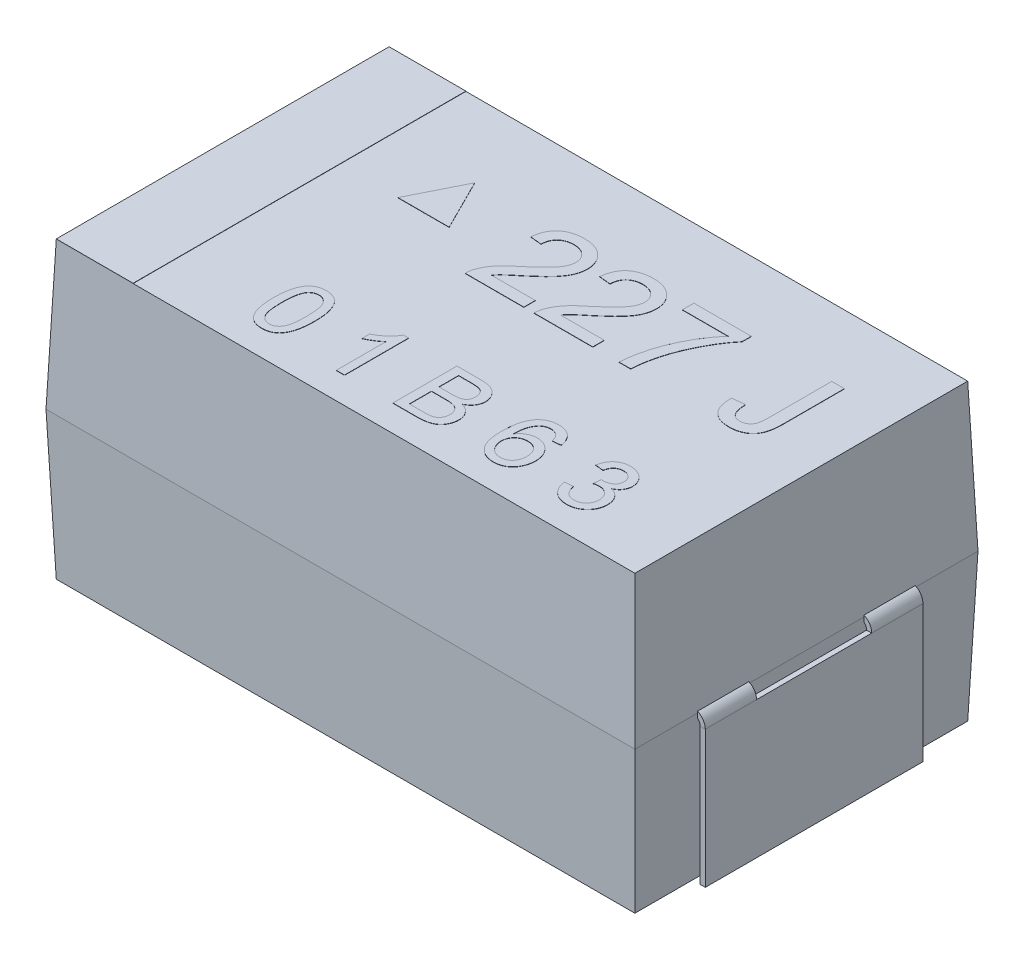
from build123d import *

# Parameters (mm, degrees)
SKETCH1_W           = 5.842
SKETCH1_H           = 3.4036
BOSS_EXTRUDE1_DEPTH = 1.4605
CUT_EXTRUDE1_DEPTH  = 4.682583942
CUT_EXTRUDE2_DEPTH  = 4.682583942
SKETCH4_W           = 0.508
SKETCH4_H           = 0.0508
SKETCH6_W           = 0.508
SKETCH6_H           = 0.0508
SKETCH8_W           = 1.143
SKETCH8_H           = 1.3589
BOSS_EXTRUDE2_DEPTH = 0.0508
SKETCH9_W           = 1.143
SKETCH9_H           = 0.508
BOSS_EXTRUDE3_DEPTH = 0.0508
SKETCH10_W          = 0.762
SKETCH10_H          = 3.301596432
BOSS_EXTRUDE4_DEPTH = 0.00254
BOSS_EXTRUDE5_DEPTH = 0.00254


with BuildPart() as part:
    # Sketch1 → Boss-Extrude1 (new, symmetric)
    with BuildSketch(Plane(origin=(0, 0, 0), x_dir=(1, 0, 0), z_dir=(0, 1, 0))):
        Rectangle(SKETCH1_W, SKETCH1_H)
    extrude(amount=BOSS_EXTRUDE1_DEPTH, both=True)

    # Sketch2 → Cut-Extrude1 (cut, symmetric)
    with BuildSketch(Plane(origin=(0, 0, 0), x_dir=(0, 0, -1), z_dir=(1, 0, 0))):
        Polygon((-1.7018, 0), (-1.650798216, 1.4605), (-1.7018, 1.4605), align=None)
        Polygon((1.650798216, 1.4605), (1.7018, 0), (1.7018, 1.4605), align=None)
    cut_extrude1 = extrude(amount=CUT_EXTRUDE1_DEPTH, both=True, mode=Mode.SUBTRACT)

    # Mirror1: Cut-Extrude1 across plane
    add(cut_extrude1.mirror(Plane.ZX), mode=Mode.SUBTRACT)

    # Sketch3 → Cut-Extrude2 (cut, symmetric)
    with BuildSketch(Plane.XY):
        Polygon((-2.921, 0), (-2.921, 1.4605), (-2.869998216, 1.4605), align=None)
        Polygon((2.921, 0), (2.921, 1.4605), (2.869998216, 1.4605), align=None)
    cut_extrude2 = extrude(amount=CUT_EXTRUDE2_DEPTH, both=True, mode=Mode.SUBTRACT)

    # Mirror2: Cut-Extrude2 across plane
    add(cut_extrude2.mirror(Plane.ZX), mode=Mode.SUBTRACT)

    # Sweep1: sweep along a path in Sketch5
    with BuildLine(Plane.XY) as sweep1_path:
        Line((2.946198216, -1.4605), (2.946198216, -0.1016))
        ThreePointArc((2.946198216, -0.1016), (2.923879753, -0.047718463), (2.869998216, -0.0254))
    # Sketch4 → Sweep1 (sweep)
    with BuildSketch(Plane(origin=(2.869998216, 0, 0), x_dir=(0, 0, -1), z_dir=(1, 0, 0))):
        with Locations((-0.8255, 0)):
            Rectangle(SKETCH4_W, SKETCH4_H)
        with Locations((0.8255, 0)):
            Rectangle(SKETCH4_W, SKETCH4_H)
    sweep(path=sweep1_path.line)

    # Sweep2: sweep along a path in Sketch7
    with BuildLine(Plane.XY) as sweep2_path:
        Line((-2.946198216, -1.4605), (-2.946198216, -0.1016))
        ThreePointArc((-2.946198216, -0.1016), (-2.923879753, -0.047718463), (-2.869998216, -0.0254))
    # Sketch6 → Sweep2 (sweep)
    with BuildSketch(Plane(origin=(-2.869998216, 0, 0), x_dir=(0, 0, -1), z_dir=(1, 0, 0))):
        with Locations((0.8255, 0)):
            Rectangle(SKETCH6_W, SKETCH6_H)
        with Locations((-0.8255, 0)):
            Rectangle(SKETCH6_W, SKETCH6_H)
    sweep(path=sweep2_path.line)

    # Sketch8 → Boss-Extrude2 (add)
    with BuildSketch(Plane(origin=(2.996998216, 0, 0), x_dir=(0, 0, -1), z_dir=(1, 0, 0))):
        with Locations((0, -0.78105)):
            Rectangle(SKETCH8_W, SKETCH8_H)
    extrude(amount=-BOSS_EXTRUDE2_DEPTH)

    # Sketch9 → Boss-Extrude3 (add)
    with BuildSketch(Plane.ZY.offset(2.996998216)):
        with Locations((0, -1.2065)):
            Rectangle(SKETCH9_W, SKETCH9_H)
    extrude(amount=-BOSS_EXTRUDE3_DEPTH)

    # Sketch10 → Boss-Extrude4 (add)
    with BuildSketch(Plane(origin=(0, 1.4605, 0), x_dir=(1, 0, 0), z_dir=(0, 1, 0))):
        with Locations((-2.488998216, 0)):
            Rectangle(SKETCH10_W, SKETCH10_H)
    extrude(amount=BOSS_EXTRUDE4_DEPTH)

    # Sketch11 → Boss-Extrude5 (add)
    # profile 1 of 10: a face of its own
    with BuildSketch(Plane(origin=(0, 1.4605, 0), x_dir=(1, 0, 0), z_dir=(0, 1, 0))):
        Polygon((-1.530311193, 0.398954098), (-1.276311193, 0.906954098), (-1.022311193, 0.398954098), align=None)
    # profile 2 of 10: a face of its own
    with BuildSketch(Plane(origin=(0, 1.4605, 0), x_dir=(1, 0, 0), z_dir=(0, 1, 0))):
        with BuildLine():
            Line((0.034964814, 0.196351855), (0.034964814, 0.082377496))
            Line((0.034964814, 0.082377496), (-0.546304417, 0.082377496))
            add(Edge.make_bspline(
                [(-0.546304417, 0.082377496), (-0.546316317, 0.089151312), (-0.546340078, 0.102676241), (-0.544051442, 0.122678753), (-0.54046698, 0.142415915), (-0.53641403, 0.155072572), (-0.534372726, 0.161447207)],
                knots=[0, 0, 0, 0, 1.01057331, 2.01775941, 3.001627217, 4, 4, 4, 4], degree=3))
            add(Edge.make_bspline(
                [(-0.534372726, 0.161447207), (-0.530601077, 0.171862602), (-0.522921376, 0.19307006), (-0.507362223, 0.22366946), (-0.489060982, 0.254083802), (-0.471242148, 0.27884537), (-0.454923943, 0.298628131), (-0.441239002, 0.314105853), (-0.426073578, 0.329949125), (-0.409439817, 0.346155053), (-0.391497808, 0.362828597), (-0.372223071, 0.380025362), (-0.351388, 0.397424868), (-0.33684294, 0.408957984), (-0.329396965, 0.414862071)],
                knots=[0, 0, 0, 0, 1.204657718, 2.452881516, 3.728232997, 5.065887527, 5.768225529, 6.518857853, 7.313994055, 8.154655305, 9.046094665, 9.979688118, 10.965752482, 12, 12, 12, 12], degree=3))
            add(Edge.make_bspline(
                [(-0.329396965, 0.414862071), (-0.317958108, 0.424489972), (-0.295931863, 0.443029104), (-0.264827354, 0.470539459), (-0.236418447, 0.496084382), (-0.211157523, 0.5201116), (-0.188837974, 0.542388064), (-0.169407394, 0.562863304), (-0.152698594, 0.581473421), (-0.138915558, 0.598892023), (-0.127286387, 0.615340028), (-0.117431692, 0.631384041), (-0.109219112, 0.647304316), (-0.102379131, 0.663050477), (-0.096969287, 0.678689861), (-0.093281709, 0.694268034), (-0.090780921, 0.709630421), (-0.090530715, 0.719852724), (-0.090406981, 0.724907945)],
                knots=[0, 0, 0, 0, 1.782554561, 3.432421876, 4.950675607, 6.337395053, 7.588547463, 8.709982106, 9.702713005, 10.569305638, 11.356701089, 12.103210377, 12.812277205, 13.490692607, 14.148717897, 14.782152033, 15.397739362, 16, 16, 16, 16], degree=3))
            add(Edge.make_bspline(
                [(-0.090406981, 0.724907945), (-0.09053073, 0.729904183), (-0.090773519, 0.73970653), (-0.093077084, 0.754052203), (-0.096283831, 0.76786743), (-0.101468165, 0.780903505), (-0.107639084, 0.793546477), (-0.115554776, 0.805396845), (-0.124711605, 0.81674995), (-0.135195399, 0.827306464), (-0.146646158, 0.837210159), (-0.159440748, 0.845442536), (-0.172738826, 0.852854128), (-0.186999163, 0.858813473), (-0.202198588, 0.863189526), (-0.218226455, 0.866365414), (-0.235080222, 0.868379097), (-0.246581733, 0.868657951), (-0.252464273, 0.868800573)],
                knots=[0, 0, 0, 0, 0.988194508, 1.938783882, 2.870742509, 3.789494954, 4.709148727, 5.651055405, 6.603531303, 7.592354411, 8.592907906, 9.593461401, 10.59787167, 11.603930315, 12.645063138, 13.723588815, 14.835711238, 16, 16, 16, 16], degree=3))
            add(Edge.make_bspline(
                [(-0.252464273, 0.868800573), (-0.258643718, 0.868658657), (-0.270737345, 0.868380918), (-0.28841499, 0.866359204), (-0.305196849, 0.863270298), (-0.321042868, 0.858547626), (-0.335933759, 0.852598218), (-0.349808875, 0.845109498), (-0.362890414, 0.836656088), (-0.374766389, 0.826647889), (-0.385505678, 0.815550837), (-0.395039666, 0.803469504), (-0.402851336, 0.790170746), (-0.409302536, 0.775946972), (-0.414489841, 0.760753468), (-0.418255647, 0.744474084), (-0.42030879, 0.727155822), (-0.42072166, 0.715296282), (-0.420932622, 0.70923647)],
                knots=[0, 0, 0, 0, 1.131143733, 2.213731411, 3.253917892, 4.251203413, 5.236093891, 6.184197493, 7.13373276, 8.082770301, 9.020476205, 9.957489029, 10.893177274, 11.836722509, 12.812818608, 13.827831385, 14.890097571, 16, 16, 16, 16], degree=3))
            Line((-0.420932622, 0.70923647), (-0.534906981, 0.720633906))
            add(Edge.make_bspline(
                [(-0.534906981, 0.720633906), (-0.533740862, 0.73056705), (-0.531472276, 0.749891126), (-0.52582154, 0.777878796), (-0.517888417, 0.803915352), (-0.508395766, 0.828363797), (-0.496495834, 0.850807947), (-0.483043985, 0.871712032), (-0.467178149, 0.890413063), (-0.44965061, 0.907500523), (-0.430269335, 0.922559072), (-0.40921638, 0.935714805), (-0.386501375, 0.946718763), (-0.362250836, 0.955829582), (-0.336409089, 0.962742189), (-0.309012692, 0.967699181), (-0.280017585, 0.970754728), (-0.260129489, 0.971166945), (-0.249971084, 0.971377496)],
                knots=[0, 0, 0, 0, 1.130804643, 2.199883102, 3.223565206, 4.205909148, 5.160801384, 6.091796021, 7.01151579, 7.927798993, 8.855738875, 9.7815393, 10.730299821, 11.705391175, 12.706931101, 13.751121791, 14.851322166, 16, 16, 16, 16], degree=3))
            add(Edge.make_bspline(
                [(-0.249971084, 0.971377496), (-0.239691088, 0.971201463), (-0.219665597, 0.970858549), (-0.190485237, 0.967349852), (-0.16295276, 0.961885088), (-0.136967235, 0.954268881), (-0.112682186, 0.944281762), (-0.090078933, 0.932079757), (-0.069053256, 0.917781895), (-0.049956453, 0.901216537), (-0.032736366, 0.883132675), (-0.017645499, 0.863833295), (-0.005028808, 0.843400845), (0.005713521, 0.822113834), (0.013681503, 0.799522481), (0.019284735, 0.77593392), (0.023092293, 0.751327993), (0.023406911, 0.734539312), (0.023567378, 0.725976454)],
                knots=[0, 0, 0, 0, 1.195390245, 2.328627238, 3.413424916, 4.457841177, 5.473507151, 6.462241215, 7.441013641, 8.425227782, 9.397253344, 10.342087291, 11.269524934, 12.186751184, 13.110685745, 14.048630397, 15.004728144, 16, 16, 16, 16], degree=3))
            add(Edge.make_bspline(
                [(0.023567378, 0.725976454), (0.023322347, 0.717179088), (0.022831746, 0.699564941), (0.019002537, 0.673236985), (0.012450719, 0.647194747), (0.003764756, 0.621121276), (-0.008102078, 0.594913087), (-0.023093807, 0.568208639), (-0.041692684, 0.540909287), (-0.05957959, 0.517701805), (-0.076229396, 0.498248082), (-0.090987876, 0.482236532), (-0.108062583, 0.465225331), (-0.126812981, 0.446625341), (-0.148003801, 0.427096715), (-0.171026182, 0.406054658), (-0.196384095, 0.384052915), (-0.213987429, 0.369022381), (-0.223080258, 0.361258506)],
                knots=[0, 0, 0, 0, 0.927118007, 1.856282007, 2.79721255, 3.754929441, 4.749232485, 5.824981375, 6.979078785, 8.228161913, 8.911614355, 9.677694854, 10.522803217, 11.452009355, 12.461436787, 13.560019032, 14.739651695, 16, 16, 16, 16], degree=3))
            add(Edge.make_bspline(
                [(-0.223080258, 0.361258506), (-0.230866894, 0.354919354), (-0.245714809, 0.342831569), (-0.266838844, 0.325307582), (-0.285759555, 0.309238562), (-0.302919398, 0.295148647), (-0.317693425, 0.282356328), (-0.330602029, 0.271421852), (-0.341176233, 0.261795438), (-0.357278874, 0.24717272), (-0.377674243, 0.226329513), (-0.392702423, 0.206076752), (-0.3999186, 0.196351855)],
                knots=[0, 0, 0, 0, 1.241996727, 2.368296581, 3.394949853, 4.3125351, 5.114548721, 5.812230366, 6.404953749, 6.883082049, 8.503329734, 10, 10, 10, 10], degree=3))
            Line((-0.3999186, 0.196351855), (0.034964814, 0.196351855))
        make_face()
    # profile 3 of 10: a face of its own
    with BuildSketch(Plane(origin=(0, 1.4605, 0), x_dir=(1, 0, 0), z_dir=(0, 1, 0))):
        with BuildLine():
            Line((0.718810967, 0.196351855), (0.718810967, 0.082377496))
            Line((0.718810967, 0.082377496), (0.137541737, 0.082377496))
            add(Edge.make_bspline(
                [(0.137541737, 0.082377496), (0.137529837, 0.089151312), (0.137506076, 0.102676241), (0.139794712, 0.122678753), (0.143379174, 0.142415915), (0.147432124, 0.155072572), (0.149473427, 0.161447207)],
                knots=[0, 0, 0, 0, 1.01057331, 2.01775941, 3.001627217, 4, 4, 4, 4], degree=3))
            add(Edge.make_bspline(
                [(0.149473427, 0.161447207), (0.153245077, 0.171862602), (0.160924778, 0.19307006), (0.176483931, 0.22366946), (0.194785172, 0.254083802), (0.212604006, 0.27884537), (0.228922211, 0.298628131), (0.242607152, 0.314105853), (0.257772576, 0.329949125), (0.274406337, 0.346155053), (0.292348345, 0.362828597), (0.311623083, 0.380025362), (0.332458154, 0.397424868), (0.347003213, 0.408957984), (0.354449189, 0.414862071)],
                knots=[0, 0, 0, 0, 1.204657718, 2.452881516, 3.728232997, 5.065887527, 5.768225529, 6.518857853, 7.313994055, 8.154655305, 9.046094665, 9.979688118, 10.965752482, 12, 12, 12, 12], degree=3))
            add(Edge.make_bspline(
                [(0.354449189, 0.414862071), (0.365888046, 0.424489972), (0.387914291, 0.443029104), (0.4190188, 0.470539459), (0.447427707, 0.496084382), (0.47268863, 0.5201116), (0.495008179, 0.542388064), (0.51443876, 0.562863304), (0.53114756, 0.581473421), (0.544930596, 0.598892023), (0.556559767, 0.615340028), (0.566414462, 0.631384041), (0.574627042, 0.647304316), (0.581467023, 0.663050477), (0.586876867, 0.678689861), (0.590564445, 0.694268034), (0.593065233, 0.709630421), (0.593315439, 0.719852724), (0.593439173, 0.724907945)],
                knots=[0, 0, 0, 0, 1.782554561, 3.432421876, 4.950675607, 6.337395053, 7.588547463, 8.709982106, 9.702713005, 10.569305638, 11.356701089, 12.103210377, 12.812277205, 13.490692607, 14.148717897, 14.782152033, 15.397739362, 16, 16, 16, 16], degree=3))
            add(Edge.make_bspline(
                [(0.593439173, 0.724907945), (0.593315424, 0.729904183), (0.593072635, 0.73970653), (0.59076907, 0.754052203), (0.587562323, 0.76786743), (0.582377989, 0.780903505), (0.57620707, 0.793546477), (0.568291378, 0.805396845), (0.559134549, 0.81674995), (0.548650755, 0.827306464), (0.537199996, 0.837210159), (0.524405405, 0.845442536), (0.511107328, 0.852854128), (0.49684699, 0.858813473), (0.481647566, 0.863189526), (0.465619698, 0.866365414), (0.448765932, 0.868379097), (0.437264421, 0.868657951), (0.431381881, 0.868800573)],
                knots=[0, 0, 0, 0, 0.988194508, 1.938783882, 2.870742509, 3.789494954, 4.709148727, 5.651055405, 6.603531303, 7.592354411, 8.592907906, 9.593461401, 10.59787167, 11.603930315, 12.645063138, 13.723588815, 14.835711238, 16, 16, 16, 16], degree=3))
            add(Edge.make_bspline(
                [(0.431381881, 0.868800573), (0.425202436, 0.868658657), (0.413108809, 0.868380918), (0.395431164, 0.866359204), (0.378649304, 0.863270298), (0.362803286, 0.858547626), (0.347912395, 0.852598218), (0.334037279, 0.845109498), (0.32095574, 0.836656088), (0.309079765, 0.826647889), (0.298340476, 0.815550837), (0.288806488, 0.803469504), (0.280994818, 0.790170746), (0.274543618, 0.775946972), (0.269356313, 0.760753468), (0.265590507, 0.744474084), (0.263537364, 0.727155822), (0.263124494, 0.715296282), (0.262913532, 0.70923647)],
                knots=[0, 0, 0, 0, 1.131143733, 2.213731411, 3.253917892, 4.251203413, 5.236093891, 6.184197493, 7.13373276, 8.082770301, 9.020476205, 9.957489029, 10.893177274, 11.836722509, 12.812818608, 13.827831385, 14.890097571, 16, 16, 16, 16], degree=3))
            Line((0.262913532, 0.70923647), (0.148939173, 0.720633906))
            add(Edge.make_bspline(
                [(0.148939173, 0.720633906), (0.150105292, 0.73056705), (0.152373878, 0.749891126), (0.158024614, 0.777878796), (0.165957737, 0.803915352), (0.175450388, 0.828363797), (0.18735032, 0.850807947), (0.200802169, 0.871712032), (0.216668005, 0.890413063), (0.234195543, 0.907500523), (0.253576819, 0.922559072), (0.274629774, 0.935714805), (0.297344778, 0.946718763), (0.321595318, 0.955829582), (0.347437065, 0.962742189), (0.374833462, 0.967699181), (0.403828569, 0.970754728), (0.423716665, 0.971166945), (0.43387507, 0.971377496)],
                knots=[0, 0, 0, 0, 1.130804643, 2.199883102, 3.223565206, 4.205909148, 5.160801384, 6.091796021, 7.01151579, 7.927798993, 8.855738875, 9.7815393, 10.730299821, 11.705391175, 12.706931101, 13.751121791, 14.851322166, 16, 16, 16, 16], degree=3))
            add(Edge.make_bspline(
                [(0.43387507, 0.971377496), (0.444155065, 0.971201463), (0.464180557, 0.970858549), (0.493360917, 0.967349852), (0.520893393, 0.961885088), (0.546878919, 0.954268881), (0.571163968, 0.944281762), (0.593767221, 0.932079757), (0.614792898, 0.917781895), (0.633889701, 0.901216537), (0.651109788, 0.883132675), (0.666200654, 0.863833295), (0.678817346, 0.843400845), (0.689559675, 0.822113834), (0.697527657, 0.799522481), (0.703130889, 0.77593392), (0.706938447, 0.751327993), (0.707253065, 0.734539312), (0.707413532, 0.725976454)],
                knots=[0, 0, 0, 0, 1.195390245, 2.328627238, 3.413424916, 4.457841177, 5.473507151, 6.462241215, 7.441013641, 8.425227782, 9.397253344, 10.342087291, 11.269524934, 12.186751184, 13.110685745, 14.048630397, 15.004728144, 16, 16, 16, 16], degree=3))
            add(Edge.make_bspline(
                [(0.707413532, 0.725976454), (0.707168501, 0.717179088), (0.7066779, 0.699564941), (0.702848691, 0.673236985), (0.696296873, 0.647194747), (0.687610909, 0.621121276), (0.675744076, 0.594913087), (0.660752347, 0.568208639), (0.642153469, 0.540909287), (0.624266564, 0.517701805), (0.607616757, 0.498248082), (0.592858278, 0.482236532), (0.575783571, 0.465225331), (0.557033173, 0.446625341), (0.535842353, 0.427096715), (0.512819971, 0.406054658), (0.487462059, 0.384052915), (0.469858725, 0.369022381), (0.460765895, 0.361258506)],
                knots=[0, 0, 0, 0, 0.927118007, 1.856282007, 2.79721255, 3.754929441, 4.749232485, 5.824981375, 6.979078785, 8.228161913, 8.911614355, 9.677694854, 10.522803217, 11.452009355, 12.461436787, 13.560019032, 14.739651695, 16, 16, 16, 16], degree=3))
            add(Edge.make_bspline(
                [(0.460765895, 0.361258506), (0.45297926, 0.354919354), (0.438131345, 0.342831569), (0.41700731, 0.325307582), (0.398086599, 0.309238562), (0.380926756, 0.295148647), (0.366152729, 0.282356328), (0.353244125, 0.271421852), (0.342669921, 0.261795438), (0.32656728, 0.24717272), (0.306171911, 0.226329513), (0.291143731, 0.206076752), (0.283927554, 0.196351855)],
                knots=[0, 0, 0, 0, 1.241996727, 2.368296581, 3.394949853, 4.3125351, 5.114548721, 5.812230366, 6.404953749, 6.883082049, 8.503329734, 10, 10, 10, 10], degree=3))
            Line((0.283927554, 0.196351855), (0.718810967, 0.196351855))
        make_face()
    # profile 4 of 10: a face of its own
    with BuildSketch(Plane(origin=(0, 1.4605, 0), x_dir=(1, 0, 0), z_dir=(0, 1, 0))):
        with BuildLine():
            Line((0.844182762, 0.846005701), (0.844182762, 0.95998006))
            Line((0.844182762, 0.95998006), (1.414054557, 0.95998006))
            Line((1.414054557, 0.95998006), (1.414054557, 0.867732063))
            add(Edge.make_bspline(
                [(1.414054557, 0.867732063), (1.407345679, 0.859886591), (1.39362838, 0.843845356), (1.37375607, 0.818294245), (1.3537805, 0.791091031), (1.334052782, 0.761974127), (1.314278144, 0.731156028), (1.294536172, 0.698538307), (1.274746273, 0.664200412), (1.248787849, 0.616120666), (1.217818111, 0.554566469), (1.185637613, 0.478720621), (1.157068767, 0.402118811), (1.141865725, 0.350022218), (1.134283123, 0.324038754)],
                knots=[0, 0, 0, 0, 0.603281671, 1.233499104, 1.891379699, 2.575603978, 3.288773649, 4.031381703, 4.80386477, 5.604951941, 7.224880277, 8.828980706, 10.418436603, 12, 12, 12, 12], degree=3))
            add(Edge.make_bspline(
                [(1.134283123, 0.324038754), (1.129365484, 0.305273476), (1.119361181, 0.267097931), (1.10840955, 0.207816145), (1.099942315, 0.146005954), (1.096617388, 0.103828612), (1.094926352, 0.082377496)],
                knots=[0, 0, 0, 0, 0.948866074, 1.930345965, 2.947387709, 4, 4, 4, 4], degree=3))
            Line((1.094926352, 0.082377496), (0.980951993, 0.082377496))
            add(Edge.make_bspline(
                [(0.980951993, 0.082377496), (0.981225367, 0.091227041), (0.981787545, 0.109425608), (0.984273543, 0.137389644), (0.987584664, 0.166743277), (0.992261341, 0.197387343), (0.998205782, 0.229384047), (1.005289361, 0.26276728), (1.013749227, 0.297467998), (1.026260887, 0.345578267), (1.044842735, 0.406072961), (1.07189656, 0.477602389), (1.103009191, 0.547904369), (1.132703785, 0.604915551), (1.158026009, 0.64931131), (1.177242067, 0.681523857), (1.197004566, 0.712218847), (1.216947127, 0.741617091), (1.237073206, 0.769743348), (1.257792781, 0.796334711), (1.278494967, 0.8219254), (1.292948575, 0.838049722), (1.300080198, 0.846005701)],
                knots=[0, 0, 0, 0, 0.630312875, 1.296201307, 1.998242258, 2.7335219, 3.502880474, 4.315318118, 5.163159648, 6.045885937, 7.85484959, 9.666009448, 11.488277305, 13.325849397, 14.240191093, 15.127469759, 15.996293014, 16.839220888, 17.656853801, 18.458354243, 19.239329216, 20, 20, 20, 20], degree=3))
            Line((1.300080198, 0.846005701), (0.844182762, 0.846005701))
        make_face()
    # profile 5 of 10: a face of its own
    with BuildSketch(Plane(origin=(0, 1.4605, 0), x_dir=(1, 0, 0), z_dir=(0, 1, 0))):
        with BuildLine():
            Line((1.847157121, 0.330449812), (1.972528916, 0.344518522))
            add(Edge.make_bspline(
                [(1.972528916, 0.344518522), (1.972867649, 0.336618534), (1.973515637, 0.321506064), (1.975663963, 0.299810042), (1.97866297, 0.280076976), (1.982376768, 0.262234801), (1.986703262, 0.246271133), (1.992131563, 0.232314765), (1.997977802, 0.220072468), (2.005165835, 0.209925068), (2.012872642, 0.201252571), (2.021350803, 0.193888803), (2.030490947, 0.187613874), (2.040274856, 0.182430298), (2.050812612, 0.178454262), (2.061994673, 0.175692369), (2.073913218, 0.173780378), (2.082102496, 0.173632985), (2.08632519, 0.173556983)],
                knots=[0, 0, 0, 0, 1.632619403, 3.123158228, 4.499702462, 5.75227728, 6.885496867, 7.90993266, 8.841891104, 9.678429245, 10.468404694, 11.232957398, 11.991194639, 12.753385178, 13.513799276, 14.310593147, 15.128879333, 16, 16, 16, 16], degree=3))
            add(Edge.make_bspline(
                [(2.08632519, 0.173556983), (2.092464448, 0.173762434), (2.104460554, 0.174163884), (2.121667555, 0.178289851), (2.137700329, 0.184480244), (2.152105414, 0.193519137), (2.164948542, 0.204517704), (2.175873222, 0.217496701), (2.184194915, 0.232496282), (2.18943609, 0.246344989), (2.192651068, 0.258671006), (2.194755101, 0.269378877), (2.196528911, 0.281324662), (2.197868702, 0.294583231), (2.199228909, 0.309116116), (2.199772303, 0.324986845), (2.200405675, 0.342079828), (2.200453095, 0.353896859), (2.200477634, 0.360011911)],
                knots=[0, 0, 0, 0, 1.177507829, 2.300849353, 3.381033894, 4.466744326, 5.550475886, 6.619462111, 7.707386998, 8.830091395, 9.455333453, 10.153234525, 10.925888378, 11.774835866, 12.713513529, 13.729654905, 14.82514671, 16, 16, 16, 16], degree=3))
            Line((2.200477634, 0.360011911), (2.200477634, 0.971377496))
            Line((2.200477634, 0.971377496), (2.325849429, 0.971377496))
            Line((2.325849429, 0.971377496), (2.325849429, 0.368025733))
            add(Edge.make_bspline(
                [(2.325849429, 0.368025733), (2.325798214, 0.359001394), (2.325699098, 0.341536916), (2.324449279, 0.31610804), (2.32227557, 0.29223751), (2.319545009, 0.269872954), (2.315799458, 0.24906164), (2.311165893, 0.229872992), (2.305914904, 0.212151203), (2.297673207, 0.191000023), (2.28512481, 0.16700365), (2.265923529, 0.141553675), (2.242715854, 0.119842992), (2.215764887, 0.101974298), (2.18571739, 0.08818425), (2.153091376, 0.078172026), (2.117962282, 0.071976093), (2.093652874, 0.071318159), (2.081160727, 0.07098006)],
                knots=[0, 0, 0, 0, 0.979376435, 1.895351937, 2.762129694, 3.580429744, 4.339931879, 5.055623694, 5.722093767, 6.344240595, 7.517202841, 8.648554164, 9.788057829, 10.949533591, 12.142879013, 13.363546981, 14.645176409, 16, 16, 16, 16], degree=3))
            add(Edge.make_bspline(
                [(2.081160727, 0.07098006), (2.071890311, 0.071182583), (2.053832587, 0.071577075), (2.027579714, 0.074713013), (2.002910333, 0.079429286), (1.980131188, 0.087015451), (1.958780133, 0.095891401), (1.939270453, 0.107298952), (1.921268199, 0.120460856), (1.905229161, 0.135941393), (1.890766327, 0.153237678), (1.878807155, 0.172888678), (1.868238356, 0.194183405), (1.860259418, 0.217714985), (1.853714567, 0.243047001), (1.849666331, 0.270502658), (1.847007303, 0.29982512), (1.84710627, 0.320055111), (1.847157121, 0.330449812)],
                knots=[0, 0, 0, 0, 1.110149412, 2.162445788, 3.163771351, 4.112774839, 5.033433762, 5.928696445, 6.813333667, 7.698542325, 8.592646346, 9.506220098, 10.44759987, 11.434914499, 12.476633792, 13.577933972, 14.755478919, 16, 16, 16, 16], degree=3))
        make_face()
    # profile 6 of 10: a face of its own
    with BuildSketch(Plane(origin=(0, 1.4605, 0), x_dir=(1, 0, 0), z_dir=(0, 1, 0))):
        with BuildLine():
            add(Edge.make_bspline(
                [(-1.288380739, -1.077404301), (-1.288298718, -1.068329568), (-1.288138074, -1.050555988), (-1.287141649, -1.024550047), (-1.285401973, -0.999853282), (-1.282805115, -0.976487141), (-1.279729949, -0.954398881), (-1.275732213, -0.933620025), (-1.27123418, -0.914103952), (-1.265837346, -0.895871005), (-1.259907994, -0.878764413), (-1.253180954, -0.862811619), (-1.245612121, -0.848029537), (-1.237573457, -0.834264868), (-1.22864179, -0.821731711), (-1.219356216, -0.810078332), (-1.209041918, -0.799732107), (-1.198127784, -0.790426826), (-1.186453102, -0.782215459), (-1.174079642, -0.775130039), (-1.161055013, -0.768874124), (-1.147130982, -0.764164673), (-1.132596608, -0.760325472), (-1.117340013, -0.757501309), (-1.101344384, -0.755836369), (-1.09041362, -0.755666012), (-1.084855098, -0.755579381)],
                knots=[0, 0, 0, 0, 1.514747001, 2.966751498, 4.343369068, 5.64627492, 6.890416844, 8.064737671, 9.177176366, 10.232018008, 11.237056675, 12.19799043, 13.119080079, 14.007588942, 14.855863561, 15.685992447, 16.491747269, 17.290132607, 18.077525251, 18.870243746, 19.668095604, 20.485086593, 21.319398728, 22.175900658, 23.072407314, 24, 24, 24, 24], degree=3))
            add(Edge.make_bspline(
                [(-1.084855098, -0.755579381), (-1.076700023, -0.755819135), (-1.060679051, -0.75629014), (-1.037288349, -0.760131573), (-1.015244121, -0.766702937), (-0.994560687, -0.77556799), (-0.975591628, -0.786828313), (-0.958651459, -0.800516952), (-0.943922907, -0.816490178), (-0.931566711, -0.834937269), (-0.920766162, -0.85534933), (-0.911171192, -0.877817979), (-0.902497617, -0.902318038), (-0.89634266, -0.92424901), (-0.891952334, -0.943180604), (-0.889046287, -0.958794846), (-0.886633686, -0.975642702), (-0.884785307, -0.993683412), (-0.883268755, -1.01289674), (-0.882097592, -1.033294651), (-0.881503107, -1.054928125), (-0.881388425, -1.06977179), (-0.881329457, -1.077404301)],
                knots=[0, 0, 0, 0, 1.134486744, 2.228744715, 3.287356444, 4.328707449, 5.352829806, 6.347195599, 7.349461267, 8.364207941, 9.428085653, 10.559314403, 11.761222316, 13.04268526, 13.726896727, 14.465273606, 15.252205015, 16.094778733, 16.988606776, 17.934225168, 18.937792761, 20, 20, 20, 20], degree=3))
            add(Edge.make_bspline(
                [(-0.881329457, -1.077404301), (-0.881413014, -1.086436409), (-0.88157626, -1.104082409), (-0.882545984, -1.129879826), (-0.884390488, -1.154390266), (-0.886660184, -1.177669875), (-0.890093759, -1.199656509), (-0.893793621, -1.220443581), (-0.898369438, -1.239936701), (-0.903708341, -1.258144412), (-0.909721158, -1.27516299), (-0.916315142, -1.291121051), (-0.923618613, -1.306007692), (-0.93184895, -1.319677715), (-0.940629576, -1.332312568), (-0.950024802, -1.343959645), (-0.960233816, -1.354451313), (-0.971246303, -1.363728683), (-0.982839015, -1.372085668), (-0.995242557, -1.379241042), (-1.008402642, -1.385169145), (-1.022231341, -1.390237379), (-1.036868968, -1.393951084), (-1.052200091, -1.396793867), (-1.068281198, -1.398467903), (-1.079254241, -1.398635078), (-1.084855098, -1.398720407)],
                knots=[0, 0, 0, 0, 1.508974709, 2.94807912, 4.311757619, 5.615040294, 6.854280449, 8.028314546, 9.141715822, 10.197470207, 11.196696834, 12.155719058, 13.080757287, 13.963948316, 14.818758719, 15.649605906, 16.461113142, 17.260189315, 18.052359509, 18.845763934, 19.647754795, 20.461145776, 21.303032214, 22.167241874, 23.064524267, 24, 24, 24, 24], degree=3))
            add(Edge.make_bspline(
                [(-1.084855098, -1.398720407), (-1.09219847, -1.398510937), (-1.106516025, -1.398102528), (-1.127425759, -1.39532764), (-1.147050659, -1.390443708), (-1.165556251, -1.383893665), (-1.182734526, -1.375132606), (-1.198667505, -1.364473068), (-1.213675348, -1.352163054), (-1.222314774, -1.342450736), (-1.226687029, -1.337535511)],
                knots=[0, 0, 0, 0, 1.10322584, 2.150986741, 3.161425019, 4.136713905, 5.093944212, 6.049774532, 7.013026876, 8, 8, 8, 8], degree=3))
            add(Edge.make_bspline(
                [(-1.226687029, -1.337535511), (-1.231719594, -1.330275962), (-1.24209696, -1.31530646), (-1.254242767, -1.28978207), (-1.265077041, -1.261683301), (-1.27357996, -1.230458857), (-1.280239865, -1.196357251), (-1.28504998, -1.159311568), (-1.287772031, -1.119337811), (-1.288173256, -1.091697679), (-1.288380739, -1.077404301)],
                knots=[0, 0, 0, 0, 0.779365345, 1.607084704, 2.489375761, 3.438383567, 4.461919411, 5.557722155, 6.737039282, 8, 8, 8, 8], degree=3))
        make_face()
        with BuildLine():
            add(Edge.make_bspline(
                [(-1.206970482, -1.077149894), (-1.206889649, -1.089363254), (-1.206734915, -1.112742326), (-1.20511832, -1.146143363), (-1.202335419, -1.176275659), (-1.198656242, -1.203097491), (-1.193798239, -1.226645143), (-1.187698442, -1.246858608), (-1.180822519, -1.263980492), (-1.172313695, -1.277798584), (-1.162997473, -1.289062345), (-1.15337911, -1.298749544), (-1.14323232, -1.306983441), (-1.132623309, -1.313848831), (-1.121387471, -1.319046854), (-1.109647667, -1.322814393), (-1.097401344, -1.324982553), (-1.089061041, -1.325294077), (-1.084855098, -1.325451176)],
                knots=[0, 0, 0, 0, 1.89448813, 3.626469325, 5.185477471, 6.587276848, 7.82441448, 8.910550357, 9.859733512, 10.6775885, 11.416198291, 12.123144072, 12.791880183, 13.439617036, 14.078171869, 14.70637855, 15.347637704, 16, 16, 16, 16], degree=3))
            add(Edge.make_bspline(
                [(-1.084855098, -1.325451176), (-1.080650207, -1.325290645), (-1.072311993, -1.324972314), (-1.060037374, -1.322851963), (-1.048343247, -1.318890475), (-1.037124162, -1.313710811), (-1.026438041, -1.307001903), (-1.016341085, -1.298736905), (-1.006672055, -1.289055458), (-0.99739768, -1.277660777), (-0.988953682, -1.263778799), (-0.981948776, -1.246670862), (-0.97594404, -1.226421998), (-0.97105938, -1.202886343), (-0.967365026, -1.176106918), (-0.964598951, -1.146058196), (-0.962971538, -1.112700134), (-0.962819357, -1.089363309), (-0.962739713, -1.077149894)],
                knots=[0, 0, 0, 0, 0.652509534, 1.29391342, 1.924290653, 2.562989607, 3.207355802, 3.876242846, 4.583348185, 5.32723334, 6.150888545, 7.094226006, 8.186903555, 9.424320409, 10.81992305, 12.379283064, 14.105084285, 16, 16, 16, 16], degree=3))
            add(Edge.make_bspline(
                [(-0.962739713, -1.077149894), (-0.962816807, -1.065190601), (-0.962964517, -1.042277048), (-0.964633903, -1.009519482), (-0.967249982, -0.979892945), (-0.970828361, -0.953370124), (-0.975584028, -0.929979813), (-0.981352002, -0.909672218), (-0.988225406, -0.892490647), (-0.996397858, -0.878262511), (-1.005495433, -0.86659158), (-1.014998713, -0.856489374), (-1.02514528, -0.847897776), (-1.036114901, -0.84100547), (-1.047554004, -0.835445014), (-1.059725432, -0.831618166), (-1.072509548, -0.829267071), (-1.081283122, -0.828989692), (-1.085745523, -0.828848612)],
                knots=[0, 0, 0, 0, 1.850066095, 3.544656626, 5.0727657, 6.45041401, 7.682899467, 8.762389858, 9.712573485, 10.538438529, 11.291566246, 11.996865408, 12.681389046, 13.341983376, 13.996294293, 14.643563182, 15.31009126, 16, 16, 16, 16], degree=3))
            add(Edge.make_bspline(
                [(-1.085745523, -0.828848612), (-1.089951202, -0.828958995), (-1.098244263, -0.829176655), (-1.11038639, -0.831254218), (-1.121893342, -0.834728368), (-1.13289695, -0.83943444), (-1.143122515, -0.845767885), (-1.152975559, -0.853162632), (-1.161994601, -0.862172306), (-1.167429397, -0.868907797), (-1.170208664, -0.872352218)],
                knots=[0, 0, 0, 0, 1.021318143, 2.013908504, 2.982026795, 3.937174072, 4.91255697, 5.897578595, 6.924855925, 8, 8, 8, 8], degree=3))
            add(Edge.make_bspline(
                [(-1.170208664, -0.872352218), (-1.173234437, -0.877411005), (-1.179624232, -0.888094098), (-1.186774042, -0.906661754), (-1.193089901, -0.927881051), (-1.198289947, -0.952078463), (-1.202051815, -0.979212481), (-1.205021665, -1.009251594), (-1.206564392, -1.042237742), (-1.206831384, -1.065191431), (-1.206970482, -1.077149894)],
                knots=[0, 0, 0, 0, 0.671104906, 1.417232262, 2.260109084, 3.195198885, 4.23592645, 5.382417421, 6.636286093, 8, 8, 8, 8], degree=3))
        make_face(mode=Mode.SUBTRACT)
    # profile 7 of 10: a face of its own
    with BuildSketch(Plane(origin=(0, 1.4605, 0), x_dir=(1, 0, 0), z_dir=(0, 1, 0))):
        with BuildLine():
            Line((-0.270752534, -1.390579381), (-0.35216279, -1.390579381))
            Line((-0.35216279, -1.390579381), (-0.35216279, -0.895757667))
            add(Edge.make_bspline(
                [(-0.35216279, -0.895757667), (-0.3568504, -0.900278289), (-0.366593083, -0.909673909), (-0.38306206, -0.922971056), (-0.401443543, -0.936448279), (-0.421498836, -0.949408135), (-0.441941815, -0.961608442), (-0.461697322, -0.972580742), (-0.480435531, -0.981865971), (-0.49277849, -0.98694317), (-0.498701252, -0.989379461)],
                knots=[0, 0, 0, 0, 0.893362401, 1.856755847, 2.901947673, 4.020460078, 5.132200827, 6.168787962, 7.121294059, 8, 8, 8, 8], degree=3))
            Line((-0.498701252, -0.989379461), (-0.498701252, -0.914329381))
            add(Edge.make_bspline(
                [(-0.498701252, -0.914329381), (-0.488528297, -0.909090289), (-0.468478006, -0.898764349), (-0.44015128, -0.880930031), (-0.413705235, -0.861596897), (-0.389577656, -0.840769225), (-0.36794882, -0.819479606), (-0.349721885, -0.797997545), (-0.334470745, -0.77711048), (-0.32681896, -0.762544068), (-0.323160386, -0.755579381)],
                knots=[0, 0, 0, 0, 1.141258006, 2.249351951, 3.335817539, 4.406819942, 5.426913362, 6.360259544, 7.215985427, 8, 8, 8, 8], degree=3))
            Line((-0.323160386, -0.755579381), (-0.270752534, -0.755579381))
            Line((-0.270752534, -0.755579381), (-0.270752534, -1.390579381))
        make_face()
    # profile 8 of 10: a face of its own
    with BuildSketch(Plane(origin=(0, 1.4605, 0), x_dir=(1, 0, 0), z_dir=(0, 1, 0))):
        with BuildLine():
            Line((0.209567979, -1.390579381), (0.209567979, -0.755579381))
            Line((0.209567979, -0.755579381), (0.447311369, -0.755579381))
            add(Edge.make_bspline(
                [(0.447311369, -0.755579381), (0.453207011, -0.755601998), (0.464711087, -0.755646131), (0.481509415, -0.756749837), (0.497418687, -0.758259477), (0.51247315, -0.76020545), (0.526607665, -0.763029018), (0.53980906, -0.766449581), (0.552146034, -0.77039509), (0.567226105, -0.776405379), (0.584604233, -0.78565649), (0.60321786, -0.799460608), (0.619412438, -0.816034402), (0.632738194, -0.835037196), (0.64371718, -0.855335763), (0.651501152, -0.876543397), (0.656477868, -0.898198356), (0.657042534, -0.912861556), (0.657324389, -0.920180744)],
                knots=[0, 0, 0, 0, 0.939712594, 1.833646414, 2.682508961, 3.487467313, 4.25240329, 4.978730417, 5.660668875, 6.315918528, 7.564895217, 8.787077865, 9.996481721, 11.241996224, 12.475862915, 13.665015424, 14.834484263, 16, 16, 16, 16], degree=3))
            add(Edge.make_bspline(
                [(0.657324389, -0.920180744), (0.6570281, -0.926990255), (0.656438378, -0.940543627), (0.651744849, -0.960508569), (0.644337024, -0.979894404), (0.63386215, -0.998465457), (0.620473948, -1.015881976), (0.603876401, -1.031554685), (0.584308014, -1.045517173), (0.56962194, -1.052959589), (0.562048949, -1.05679733)],
                knots=[0, 0, 0, 0, 0.926741525, 1.844548388, 2.778836836, 3.746021974, 4.738420572, 5.759761325, 6.844803049, 8, 8, 8, 8], degree=3))
            add(Edge.make_bspline(
                [(0.562048949, -1.05679733), (0.566733651, -1.058263843), (0.575905502, -1.061135025), (0.58909099, -1.066388887), (0.601468136, -1.07237116), (0.613063882, -1.079091675), (0.623799877, -1.086612668), (0.633645829, -1.094945863), (0.642670003, -1.103962307), (0.650856279, -1.113656514), (0.658047063, -1.123966101), (0.664496298, -1.13466574), (0.669821796, -1.14588428), (0.674186913, -1.157592593), (0.677592353, -1.169718332), (0.680037829, -1.182308136), (0.681431689, -1.195332699), (0.681641042, -1.20418055), (0.681747466, -1.20867834)],
                knots=[0, 0, 0, 0, 1.127427615, 2.20731145, 3.257257018, 4.283066884, 5.282973838, 6.264540225, 7.242620376, 8.210460609, 9.17525685, 10.12748095, 11.077310519, 12.023587065, 12.994999128, 13.967387486, 14.966724908, 16, 16, 16, 16], degree=3))
            add(Edge.make_bspline(
                [(0.681747466, -1.20867834), (0.681528109, -1.215899478), (0.681093318, -1.230212654), (0.677601454, -1.251279241), (0.67170039, -1.271543523), (0.663578078, -1.290677849), (0.653900015, -1.308370351), (0.642900558, -1.324157781), (0.630860215, -1.337877688), (0.617439943, -1.349418582), (0.602726308, -1.359213423), (0.586303735, -1.36746132), (0.5682992, -1.374735175), (0.548346771, -1.380545799), (0.52645553, -1.385161751), (0.502328394, -1.388160742), (0.475928294, -1.390307618), (0.457535023, -1.390486262), (0.447947386, -1.390579381)],
                knots=[0, 0, 0, 0, 1.028073207, 2.037766189, 3.031549473, 4.027532207, 4.992436545, 5.898794514, 6.762903869, 7.584966804, 8.412380356, 9.273953678, 10.198004568, 11.174406109, 12.229717296, 13.381036288, 14.634844708, 16, 16, 16, 16], degree=3))
            Line((0.447947386, -1.390579381), (0.209567979, -1.390579381))
        make_face()
        with BuildLine():
            Line((0.299119261, -1.024233227), (0.430011689, -1.024233227))
            add(Edge.make_bspline(
                [(0.430011689, -1.024233227), (0.434294815, -1.024216282), (0.442523668, -1.024183725), (0.454393592, -1.023729791), (0.465348963, -1.023342521), (0.475347404, -1.022370501), (0.484438448, -1.021418451), (0.492585714, -1.020136843), (0.499829108, -1.018692762), (0.504264239, -1.017353268), (0.506333804, -1.016728219)],
                knots=[0, 0, 0, 0, 1.335841395, 2.566453063, 3.705076039, 4.753984432, 5.69893722, 6.555639608, 7.326018133, 8, 8, 8, 8], degree=3))
            add(Edge.make_bspline(
                [(0.506333804, -1.016728219), (0.51119654, -1.015024803), (0.520570878, -1.011740972), (0.533133367, -1.004283061), (0.543832956, -0.995333605), (0.552640973, -0.984734577), (0.559409497, -0.9725427), (0.564428163, -0.959010804), (0.567175993, -0.943949724), (0.567568659, -0.933505394), (0.567773107, -0.928067362)],
                knots=[0, 0, 0, 0, 1.059015028, 2.041559358, 2.989777133, 3.920090524, 4.862499371, 5.848878527, 6.879979022, 8, 8, 8, 8], degree=3))
            add(Edge.make_bspline(
                [(0.567773107, -0.928067362), (0.567608717, -0.922841061), (0.567288339, -0.912655603), (0.564599052, -0.897864553), (0.55994534, -0.884104196), (0.553642939, -0.871377552), (0.545662426, -0.860055374), (0.536137405, -0.850320952), (0.524727102, -0.842962157), (0.514061886, -0.838371725), (0.50446937, -0.835499977), (0.495898794, -0.833800882), (0.486177204, -0.832303811), (0.47527261, -0.83103105), (0.463180886, -0.830043271), (0.449864776, -0.829258545), (0.435355978, -0.82892537), (0.425305236, -0.828874835), (0.420089814, -0.828848612)],
                knots=[0, 0, 0, 0, 1.216168307, 2.37017178, 3.484610845, 4.588286376, 5.664695412, 6.69777344, 7.738183022, 8.803673002, 9.390844981, 10.0665252, 10.835811589, 11.680682236, 12.621801058, 13.660007223, 14.785756265, 16, 16, 16, 16], degree=3))
            Line((0.420089814, -0.828848612), (0.299119261, -0.828848612))
            Line((0.299119261, -0.828848612), (0.299119261, -1.024233227))
        make_face(mode=Mode.SUBTRACT)
        with BuildLine():
            Line((0.299119261, -1.317310151), (0.449346625, -1.317310151))
            add(Edge.make_bspline(
                [(0.449346625, -1.317310151), (0.455325327, -1.317241464), (0.466309853, -1.317115267), (0.481334539, -1.316719382), (0.49347913, -1.315752383), (0.50057093, -1.314711172), (0.50366253, -1.314257266)],
                knots=[0, 0, 0, 0, 1.317581857, 2.420761387, 3.311546315, 4, 4, 4, 4], degree=3))
            add(Edge.make_bspline(
                [(0.50366253, -1.314257266), (0.508094968, -1.313325612), (0.516677314, -1.31152169), (0.528776362, -1.307495524), (0.539869659, -1.302883337), (0.549763589, -1.297021759), (0.558925131, -1.290266692), (0.566887193, -1.28182929), (0.57422063, -1.272242972), (0.580574407, -1.261272522), (0.585712359, -1.249136282), (0.589639208, -1.236021764), (0.591730933, -1.221974952), (0.592038912, -1.212331052), (0.592196184, -1.207406304)],
                knots=[0, 0, 0, 0, 1.067651492, 2.067249321, 3.003744366, 3.895862395, 4.774133402, 5.679610569, 6.621910665, 7.616993802, 8.661192143, 9.724711987, 10.838102842, 12, 12, 12, 12], degree=3))
            add(Edge.make_bspline(
                [(0.592196184, -1.207406304), (0.592020966, -1.201624355), (0.591679272, -1.190348965), (0.588431355, -1.174055454), (0.583066328, -1.15894302), (0.575513933, -1.145220955), (0.566250526, -1.132879139), (0.55504274, -1.122409912), (0.541974378, -1.114102063), (0.527005276, -1.10758201), (0.509509395, -1.102943104), (0.489003708, -1.099795887), (0.46516022, -1.097765064), (0.448121704, -1.097593743), (0.439043139, -1.097502458)],
                knots=[0, 0, 0, 0, 0.96167883, 1.875371887, 2.752872588, 3.621584364, 4.472914353, 5.312011319, 6.159851575, 7.038572308, 8.019870099, 9.164119506, 10.488969081, 12, 12, 12, 12], degree=3))
            Line((0.439043139, -1.097502458), (0.299119261, -1.097502458))
            Line((0.299119261, -1.097502458), (0.299119261, -1.317310151))
        make_face(mode=Mode.SUBTRACT)
    # profile 9 of 10: a face of its own
    with BuildSketch(Plane(origin=(0, 1.4605, 0), x_dir=(1, 0, 0), z_dir=(0, 1, 0))):
        with BuildLine():
            Line((1.406298748, -0.918399894), (1.324888492, -0.92654092))
            add(Edge.make_bspline(
                [(1.324888492, -0.92654092), (1.323131724, -0.919539203), (1.319824879, -0.90635955), (1.312890456, -0.888483338), (1.305248869, -0.873363104), (1.298609992, -0.865221275), (1.295504477, -0.861412715)],
                knots=[0, 0, 0, 0, 1.199207122, 2.257322842, 3.184815751, 4, 4, 4, 4], degree=3))
            add(Edge.make_bspline(
                [(1.295504477, -0.861412715), (1.292838755, -0.858815068), (1.287595895, -0.853706097), (1.278989028, -0.847046518), (1.269915966, -0.841404188), (1.260349285, -0.836833045), (1.250340671, -0.833222105), (1.239848664, -0.83069606), (1.228897033, -0.829132295), (1.221434865, -0.828943978), (1.21765592, -0.828848612)],
                knots=[0, 0, 0, 0, 1.028360939, 2.022547923, 3.001693811, 3.976902288, 4.948369586, 5.937776631, 6.955661634, 8, 8, 8, 8], degree=3))
            add(Edge.make_bspline(
                [(1.21765592, -0.828848612), (1.2115296, -0.829045872), (1.199424259, -0.829435649), (1.18166356, -0.833251536), (1.164412929, -0.838962619), (1.153725526, -0.84475198), (1.148329998, -0.847674734)],
                knots=[0, 0, 0, 0, 1.010336883, 1.996381556, 2.988474728, 4, 4, 4, 4], degree=3))
            add(Edge.make_bspline(
                [(1.148329998, -0.847674734), (1.143023832, -0.85207103), (1.132131541, -0.861095574), (1.117916968, -0.877771042), (1.105205062, -0.897186265), (1.095829802, -0.915311855), (1.089231792, -0.931563041), (1.084964559, -0.945490801), (1.081318738, -0.96087811), (1.078281564, -0.977695977), (1.075932505, -0.995958042), (1.073969162, -1.015675905), (1.072883267, -1.036899559), (1.072641409, -1.051538518), (1.072516697, -1.059086994)],
                knots=[0, 0, 0, 0, 1.063306303, 2.18271343, 3.369442992, 4.644240368, 5.329284104, 6.077448525, 6.892756613, 7.771869145, 8.717113863, 9.73749892, 10.833357348, 12, 12, 12, 12], degree=3))
            add(Edge.make_bspline(
                [(1.072516697, -1.059086994), (1.077316372, -1.052343594), (1.086712027, -1.039142979), (1.103286675, -1.021875595), (1.121385424, -1.007279175), (1.14102851, -0.995624912), (1.161703384, -0.986592569), (1.182954139, -0.980092986), (1.204743531, -0.97610337), (1.219420153, -0.975627053), (1.226814574, -0.975387074)],
                knots=[0, 0, 0, 0, 1.083917396, 2.121834425, 3.126226247, 4.123362703, 5.106535049, 6.077135049, 7.031216202, 8, 8, 8, 8], degree=3))
            add(Edge.make_bspline(
                [(1.226814574, -0.975387074), (1.233182982, -0.975558417), (1.245764984, -0.975896939), (1.264293407, -0.978579566), (1.282056703, -0.983271665), (1.29920881, -0.989384202), (1.315420118, -0.997730242), (1.331086278, -1.007484304), (1.345844458, -1.01935388), (1.35988144, -1.032690701), (1.372661566, -1.04751828), (1.383972883, -1.063476976), (1.393399008, -1.080605043), (1.401042504, -1.098787771), (1.407024876, -1.117958996), (1.41137178, -1.138173161), (1.413916399, -1.159470216), (1.414262978, -1.174029735), (1.414439774, -1.181456785)],
                knots=[0, 0, 0, 0, 0.981553735, 1.939246043, 2.877808487, 3.810434071, 4.740031046, 5.683044261, 6.650811044, 7.654063953, 8.664382933, 9.663624521, 10.66421212, 11.671863278, 12.699354266, 13.755775259, 14.855184124, 16, 16, 16, 16], degree=3))
            add(Edge.make_bspline(
                [(1.414439774, -1.181456785), (1.414123019, -1.191272205), (1.413497911, -1.2106427), (1.408480439, -1.239168344), (1.40039553, -1.266664307), (1.390723931, -1.288438726), (1.381838257, -1.305120258), (1.37429328, -1.316788062), (1.366225572, -1.327752857), (1.357787949, -1.33816553), (1.348368424, -1.347549508), (1.338538062, -1.356346961), (1.327971933, -1.364253737), (1.316980798, -1.371532919), (1.305357027, -1.377844712), (1.293438841, -1.383453422), (1.28112813, -1.388231012), (1.268385145, -1.391982226), (1.255275148, -1.395085682), (1.241754504, -1.397219594), (1.227858797, -1.398535632), (1.218464515, -1.398658338), (1.21371261, -1.398720407)],
                knots=[0, 0, 0, 0, 1.777979151, 3.508799182, 5.232661887, 6.960203328, 7.816385973, 8.656273476, 9.47551652, 10.283326439, 11.082130802, 11.882412381, 12.672407567, 13.471692325, 14.269609044, 15.067192643, 15.857822979, 16.66013129, 17.472860815, 18.297850482, 19.139002666, 20, 20, 20, 20], degree=3))
            add(Edge.make_bspline(
                [(1.21371261, -1.398720407), (1.205687533, -1.398497867), (1.189948944, -1.398061428), (1.166913218, -1.394708502), (1.145039788, -1.389105292), (1.124282126, -1.381271372), (1.104576999, -1.371381207), (1.086118595, -1.358983205), (1.06880478, -1.344444984), (1.052622205, -1.327682228), (1.037949479, -1.308326287), (1.025409505, -1.285983591), (1.014724335, -1.260849717), (1.005979454, -1.232855513), (0.999362102, -1.201971705), (0.994597331, -1.16826462), (0.991667049, -1.131729431), (0.991297679, -1.106412402), (0.991106441, -1.093304742)],
                knots=[0, 0, 0, 0, 0.898506621, 1.76212948, 2.600594211, 3.422599815, 4.24233914, 5.064166416, 5.906856258, 6.769969817, 7.668413694, 8.619051846, 9.63165591, 10.722000005, 11.898403521, 13.164960021, 14.532183992, 16, 16, 16, 16], degree=3))
            add(Edge.make_bspline(
                [(0.991106441, -1.093304742), (0.991138151, -1.085840818), (0.991200693, -1.071119407), (0.992205701, -1.049453161), (0.993358569, -1.028529163), (0.995333827, -1.008430891), (0.997666087, -0.989067948), (1.00079595, -0.970554205), (1.004157045, -0.952745756), (1.008243452, -0.935782815), (1.012798796, -0.919505802), (1.018042155, -0.904093568), (1.023580442, -0.889346705), (1.029863512, -0.875497845), (1.036559802, -0.862321437), (1.04396157, -0.850061313), (1.051724014, -0.838437144), (1.057454572, -0.831269316), (1.060305159, -0.82770378)],
                knots=[0, 0, 0, 0, 1.28053818, 2.525659045, 3.721026795, 4.875695215, 5.990149104, 7.066600796, 8.096771069, 9.099076143, 10.059445332, 10.995815448, 11.891625124, 12.761078582, 13.603822678, 14.426062074, 15.217066536, 16, 16, 16, 16], degree=3))
            add(Edge.make_bspline(
                [(1.060305159, -0.82770378), (1.065433312, -0.821935618), (1.075541379, -0.810566033), (1.092833104, -0.795879223), (1.111258893, -0.783334428), (1.131112616, -0.77319932), (1.15224253, -0.765297664), (1.17466188, -0.759561762), (1.198433228, -0.756235335), (1.214677333, -0.755801576), (1.222998468, -0.755579381)],
                knots=[0, 0, 0, 0, 1.005002357, 1.980952959, 2.948226316, 3.90482984, 4.879026092, 5.883055346, 6.915583142, 8, 8, 8, 8], degree=3))
            add(Edge.make_bspline(
                [(1.222998468, -0.755579381), (1.229194476, -0.755688908), (1.241367034, -0.755904081), (1.259202938, -0.75796869), (1.276168017, -0.761419374), (1.292300056, -0.766073961), (1.307505253, -0.77226981), (1.321958904, -0.779612563), (1.335514245, -0.788445433), (1.348073141, -0.798647743), (1.359666702, -0.809930286), (1.370050893, -0.822387808), (1.379186587, -0.835865044), (1.387145227, -0.850390024), (1.393855695, -0.865893992), (1.399365323, -0.882443583), (1.403553007, -0.900034542), (1.405370815, -0.912193254), (1.406298748, -0.918399894)],
                knots=[0, 0, 0, 0, 1.095988384, 2.15315746, 3.171326302, 4.156539379, 5.119213808, 6.072133135, 7.021027441, 7.975952916, 8.930907862, 9.879001051, 10.840359051, 11.807350428, 12.805278655, 13.825435679, 14.889953203, 16, 16, 16, 16], degree=3))
        make_face()
        with BuildLine():
            add(Edge.make_bspline(
                [(1.072516697, -1.179803139), (1.072743136, -1.186177525), (1.073193042, -1.198842614), (1.076634311, -1.217641765), (1.082254145, -1.235983765), (1.089956192, -1.253664907), (1.099466801, -1.270092482), (1.110763188, -1.284648447), (1.123600153, -1.297119084), (1.137908708, -1.307531455), (1.153655267, -1.315533075), (1.170557804, -1.321328328), (1.188636514, -1.324830998), (1.201103724, -1.325241328), (1.207479638, -1.325451176)],
                knots=[0, 0, 0, 0, 1.034121613, 2.054667162, 3.090870403, 4.141799978, 5.178094622, 6.163726224, 7.122467907, 8.07367165, 9.024701118, 9.977919151, 10.965878387, 12, 12, 12, 12], degree=3))
            add(Edge.make_bspline(
                [(1.207479638, -1.325451176), (1.212023201, -1.325328296), (1.220891834, -1.325088444), (1.233876954, -1.323229832), (1.246266193, -1.320371841), (1.257987814, -1.316149178), (1.26902591, -1.310759898), (1.279437793, -1.304200791), (1.289216732, -1.296452219), (1.29824449, -1.287528406), (1.30640363, -1.277603521), (1.313492841, -1.26673847), (1.319753276, -1.25511201), (1.324462123, -1.242438425), (1.328299151, -1.229042401), (1.3311201, -1.214797274), (1.332776293, -1.199686688), (1.332943887, -1.189305188), (1.333029518, -1.184000856)],
                knots=[0, 0, 0, 0, 1.023436885, 1.997658284, 2.950132304, 3.883974581, 4.798406504, 5.712938251, 6.651509614, 7.604127386, 8.56812849, 9.540661787, 10.523651728, 11.536824179, 12.580180944, 13.661349568, 14.805088061, 16, 16, 16, 16], degree=3))
            add(Edge.make_bspline(
                [(1.333029518, -1.184000856), (1.332950097, -1.178907183), (1.332794779, -1.168945863), (1.331047132, -1.15441018), (1.328501228, -1.140668806), (1.324592972, -1.127837366), (1.319796256, -1.115780017), (1.313786023, -1.104586952), (1.306782966, -1.09416304), (1.29857217, -1.084784301), (1.289593077, -1.076239719), (1.279731656, -1.068817934), (1.269106258, -1.062549833), (1.257678552, -1.057418337), (1.245427011, -1.053485648), (1.232377005, -1.0507602), (1.218601962, -1.048857717), (1.209140101, -1.048724471), (1.20429955, -1.048656304)],
                knots=[0, 0, 0, 0, 1.155658139, 2.260035327, 3.319019312, 4.323913291, 5.299809325, 6.260058621, 7.202437855, 8.144128683, 9.083751266, 10.011616631, 10.939332216, 11.87851101, 12.849505762, 13.853846437, 14.90205895, 16, 16, 16, 16], degree=3))
            add(Edge.make_bspline(
                [(1.20429955, -1.048656304), (1.19979783, -1.048726641), (1.190926765, -1.048865244), (1.177917272, -1.050782572), (1.165378762, -1.053513483), (1.153361297, -1.057486574), (1.141860743, -1.062603158), (1.13087965, -1.068826875), (1.120513377, -1.076336017), (1.110667403, -1.084745392), (1.101683071, -1.094087047), (1.093800634, -1.104193607), (1.087371389, -1.115130093), (1.081751185, -1.126628953), (1.077633457, -1.138961249), (1.074703642, -1.151961644), (1.072887232, -1.165632536), (1.07264213, -1.175006114), (1.072516697, -1.179803139)],
                knots=[0, 0, 0, 0, 1.036988316, 2.04348404, 3.025371103, 3.992992706, 4.955812186, 5.923433788, 6.897355974, 7.902569022, 8.905116476, 9.880852345, 10.849905012, 11.825004025, 12.826645469, 13.839294292, 14.894236693, 16, 16, 16, 16], degree=3))
        make_face(mode=Mode.SUBTRACT)
    # profile 10 of 10: a face of its own
    with BuildSketch(Plane(origin=(0, 1.4605, 0), x_dir=(1, 0, 0), z_dir=(0, 1, 0))):
        with BuildLine():
            Line((1.7400808, -1.219617843), (1.821491056, -1.211476817))
            add(Edge.make_bspline(
                [(1.821491056, -1.211476817), (1.822576352, -1.216368428), (1.82467632, -1.225833331), (1.828716914, -1.239392788), (1.832984669, -1.251978996), (1.83827538, -1.263310432), (1.843437964, -1.273850505), (1.849504782, -1.283163709), (1.855987294, -1.291493037), (1.863005341, -1.298807561), (1.870639794, -1.30510626), (1.878788867, -1.310617961), (1.887624907, -1.315220973), (1.897080262, -1.318865437), (1.907075296, -1.321815662), (1.917664326, -1.323981959), (1.928903347, -1.325272448), (1.936606783, -1.325390628), (1.940553556, -1.325451176)],
                knots=[0, 0, 0, 0, 1.321063709, 2.556160278, 3.730472002, 4.821700466, 5.852032229, 6.822994757, 7.746964065, 8.632786469, 9.490489437, 10.352773447, 11.223141997, 12.11199479, 13.021433979, 13.96892724, 14.959401504, 16, 16, 16, 16], degree=3))
            add(Edge.make_bspline(
                [(1.940553556, -1.325451176), (1.945182981, -1.325385172), (1.954224256, -1.325256265), (1.967398885, -1.323322173), (1.979936868, -1.320666479), (1.991659321, -1.3165022), (2.002729473, -1.311412681), (2.013084256, -1.305123115), (2.022794548, -1.29773759), (2.031668821, -1.28920587), (2.039605062, -1.279820707), (2.046673399, -1.269907578), (2.052517964, -1.2593819), (2.057444052, -1.248391929), (2.06108015, -1.236760072), (2.063742067, -1.224631372), (2.065481643, -1.21195098), (2.065640666, -1.203299217), (2.065721825, -1.198883668)],
                knots=[0, 0, 0, 0, 1.111377895, 2.170522867, 3.193923215, 4.186422864, 5.152846954, 6.117443035, 7.091571248, 8.078879332, 9.069127402, 10.041602243, 10.999610288, 11.957618333, 12.930786866, 13.922135183, 14.939532534, 16, 16, 16, 16], degree=3))
            add(Edge.make_bspline(
                [(2.065721825, -1.198883668), (2.065626439, -1.194681599), (2.065439823, -1.186460587), (2.063905692, -1.174393904), (2.061228668, -1.162939367), (2.057517672, -1.152030685), (2.05277578, -1.141683872), (2.047076167, -1.13181337), (2.040105072, -1.122635492), (2.03225849, -1.114051658), (2.023700158, -1.106143485), (2.014334379, -1.099416566), (2.004478058, -1.093611015), (1.994013733, -1.08892326), (1.982984851, -1.085202562), (1.971401926, -1.082528423), (1.959209269, -1.080993626), (1.950903783, -1.080806978), (1.946659325, -1.080711593)],
                knots=[0, 0, 0, 0, 1.072815875, 2.098878726, 3.09954706, 4.07199174, 5.036203424, 6.001873089, 6.97636515, 7.972747947, 8.969130744, 9.945905975, 10.911575641, 11.885646534, 12.868345115, 13.879560892, 14.916365174, 16, 16, 16, 16], degree=3))
            add(Edge.make_bspline(
                [(1.946659325, -1.080711593), (1.942922338, -1.080810597), (1.93499158, -1.081020708), (1.92247419, -1.082875907), (1.90860906, -1.085473619), (1.899027859, -1.088022889), (1.893997066, -1.089361433)],
                knots=[0, 0, 0, 0, 0.837610211, 1.777604146, 2.833088267, 4, 4, 4, 4], degree=3))
            Line((1.893997066, -1.089361433), (1.902392498, -1.016092202))
            add(Edge.make_bspline(
                [(1.902392498, -1.016092202), (1.904595264, -1.016332904), (1.908486791, -1.016758142), (1.912397944, -1.016914691), (1.914095223, -1.016982627)],
                knots=[0, 0, 0, 0, 1.132082448, 2, 2, 2, 2], degree=3))
            add(Edge.make_bspline(
                [(1.914095223, -1.016982627), (1.92158227, -1.016696774), (1.936269504, -1.016136021), (1.957680645, -1.011476634), (1.977972126, -1.004140579), (1.993648606, -0.995387601), (2.005273753, -0.98715495), (2.012604338, -0.979732048), (2.019213238, -0.971854848), (2.024144018, -0.962819415), (2.028403907, -0.95321905), (2.031041834, -0.942675567), (2.032965626, -0.931445253), (2.033092541, -0.923666832), (2.033157723, -0.919671929)],
                knots=[0, 0, 0, 0, 1.557468908, 3.055264441, 4.54122591, 6.035034992, 6.780215604, 7.498173296, 8.201377046, 8.913174237, 9.633083494, 10.382644491, 11.169345745, 12, 12, 12, 12], degree=3))
            add(Edge.make_bspline(
                [(2.033157723, -0.919671929), (2.033097565, -0.916445112), (2.032979912, -0.910134366), (2.031669213, -0.900882147), (2.029501477, -0.892115385), (2.026571566, -0.883740474), (2.022731627, -0.875801306), (2.0179698, -0.868307601), (2.012529253, -0.861107342), (2.006106878, -0.854572593), (1.999229073, -0.848437433), (1.99164503, -0.843270371), (1.983715695, -0.838680195), (1.975161417, -0.835211614), (1.966193382, -0.832359874), (1.956734929, -0.830361491), (1.946782606, -0.829019442), (1.93996455, -0.828906357), (1.936483043, -0.828848612)],
                knots=[0, 0, 0, 0, 1.041493611, 2.036867705, 3.009952345, 3.954088258, 4.897230656, 5.850851638, 6.817653571, 7.805463921, 8.805067469, 9.788883576, 10.763797054, 11.758134544, 12.762883247, 13.799594994, 14.876406454, 16, 16, 16, 16], degree=3))
            add(Edge.make_bspline(
                [(1.936483043, -0.828848612), (1.929669823, -0.829114271), (1.916512485, -0.829627297), (1.897674916, -0.834373855), (1.880604678, -0.842054402), (1.867966696, -0.851061541), (1.858992618, -0.859672875), (1.852862847, -0.866971973), (1.847380115, -0.875032306), (1.842528882, -0.883851001), (1.838374689, -0.893463524), (1.834629799, -0.903750789), (1.831730907, -0.914877495), (1.83034355, -0.922587206), (1.829632082, -0.92654092)],
                knots=[0, 0, 0, 0, 1.533565899, 2.961543033, 4.347411787, 5.731829577, 6.434842101, 7.147085226, 7.87612511, 8.629021686, 9.412189982, 10.234506416, 11.094615066, 12, 12, 12, 12], degree=3))
            Line((1.829632082, -0.92654092), (1.748221825, -0.918399894))
            add(Edge.make_bspline(
                [(1.748221825, -0.918399894), (1.749495325, -0.912105165), (1.751993394, -0.899757557), (1.757082775, -0.881924247), (1.763289212, -0.865183847), (1.770741082, -0.849613109), (1.779086336, -0.835025687), (1.788713192, -0.821594612), (1.799395948, -0.809240033), (1.81115358, -0.797999634), (1.82382647, -0.7879607), (1.837350789, -0.779300803), (1.851615548, -0.771960292), (1.866634103, -0.766042541), (1.882394561, -0.761230513), (1.898941762, -0.758042533), (1.916200806, -0.755886025), (1.927953511, -0.755682853), (1.933938973, -0.755579381)],
                knots=[0, 0, 0, 0, 1.136581168, 2.229493434, 3.279335563, 4.293305329, 5.282068175, 6.250623624, 7.213783178, 8.169396253, 9.125981663, 10.071280146, 11.007896369, 11.961295906, 12.925420184, 13.920544621, 14.940967302, 16, 16, 16, 16], degree=3))
            add(Edge.make_bspline(
                [(1.933938973, -0.755579381), (1.942224276, -0.755848053), (1.958515861, -0.756376349), (1.982444402, -0.76057214), (2.005331926, -0.767457516), (2.026994258, -0.777001876), (2.04705871, -0.788664831), (2.064814095, -0.802642173), (2.080023049, -0.818692096), (2.092390172, -0.836639128), (2.102183199, -0.855747355), (2.109429744, -0.875582522), (2.113759664, -0.896121798), (2.114297993, -0.910026882), (2.114567979, -0.917000655)],
                knots=[0, 0, 0, 0, 1.104647871, 2.172094857, 3.229560912, 4.285649672, 5.322588163, 6.317201348, 7.289435229, 8.260615662, 9.214246199, 10.146367077, 11.070353327, 12, 12, 12, 12], degree=3))
            add(Edge.make_bspline(
                [(2.114567979, -0.917000655), (2.114294267, -0.923592942), (2.113753835, -0.936609095), (2.109593149, -0.955641017), (2.102562416, -0.973671624), (2.093059506, -0.990764175), (2.080736563, -1.006549031), (2.065627435, -1.020614777), (2.047973827, -1.033096), (2.034743942, -1.039592339), (2.027942378, -1.042932146)],
                knots=[0, 0, 0, 0, 0.975609618, 1.926294443, 2.868398979, 3.832526731, 4.812148358, 5.820404151, 6.879456693, 8, 8, 8, 8], degree=3))
            add(Edge.make_bspline(
                [(2.027942378, -1.042932146), (2.032502373, -1.044083454), (2.041434071, -1.046338531), (2.054262016, -1.051010988), (2.066321723, -1.056481258), (2.077773702, -1.062676984), (2.088285478, -1.070004433), (2.098219384, -1.078016169), (2.107199895, -1.08709804), (2.115487192, -1.096926355), (2.123027615, -1.107398257), (2.129372955, -1.118717449), (2.134848799, -1.130586369), (2.139518078, -1.143091102), (2.142873412, -1.156328069), (2.145272581, -1.170194722), (2.146855837, -1.184642885), (2.147039098, -1.194512149), (2.147132082, -1.199519686)],
                knots=[0, 0, 0, 0, 1.053251915, 2.063013066, 3.05373318, 4.018979697, 4.975584284, 5.920798056, 6.874756953, 7.832116109, 8.799604348, 9.761196922, 10.734637845, 11.72654167, 12.747371341, 13.789206138, 14.878271633, 16, 16, 16, 16], degree=3))
            add(Edge.make_bspline(
                [(2.147132082, -1.199519686), (2.146977137, -1.206356179), (2.14667262, -1.219792081), (2.143785792, -1.239529727), (2.139068067, -1.258441045), (2.132539368, -1.276590255), (2.124266474, -1.294051427), (2.113885357, -1.310578154), (2.101703688, -1.326304776), (2.087911913, -1.341080716), (2.072801702, -1.35466026), (2.056392592, -1.366418846), (2.039009234, -1.376404423), (2.020623342, -1.384547612), (2.001283654, -1.390945342), (1.980970932, -1.39553144), (1.959622318, -1.398226736), (1.945055839, -1.398553685), (1.937627875, -1.398720407)],
                knots=[0, 0, 0, 0, 1.016055063, 1.996874249, 2.958724482, 3.910019225, 4.860394196, 5.826121543, 6.806008102, 7.814207964, 8.82789325, 9.821757317, 10.810247154, 11.803791187, 12.806673825, 13.834534493, 14.895752369, 16, 16, 16, 16], degree=3))
            add(Edge.make_bspline(
                [(1.937627875, -1.398720407), (1.930961893, -1.398594847), (1.917838841, -1.398347662), (1.898629402, -1.395772415), (1.880225761, -1.392117845), (1.862773443, -1.386483885), (1.846069725, -1.379613362), (1.830397506, -1.370823564), (1.815474989, -1.360733217), (1.801582324, -1.349054036), (1.788796667, -1.336163274), (1.77739033, -1.322251595), (1.767595632, -1.307349888), (1.758959685, -1.29168111), (1.751979607, -1.274949898), (1.74654451, -1.257299899), (1.742400177, -1.238796618), (1.740862337, -1.226080327), (1.7400808, -1.219617843)],
                knots=[0, 0, 0, 0, 1.08471039, 2.135426191, 3.150939737, 4.135689946, 5.116584603, 6.086901885, 7.055842759, 8.045878862, 9.036901429, 10.008421467, 10.96965771, 11.936653536, 12.917548193, 13.915472582, 14.940632654, 16, 16, 16, 16], degree=3))
        make_face()
    extrude(amount=BOSS_EXTRUDE5_DEPTH)


solid = part.part
